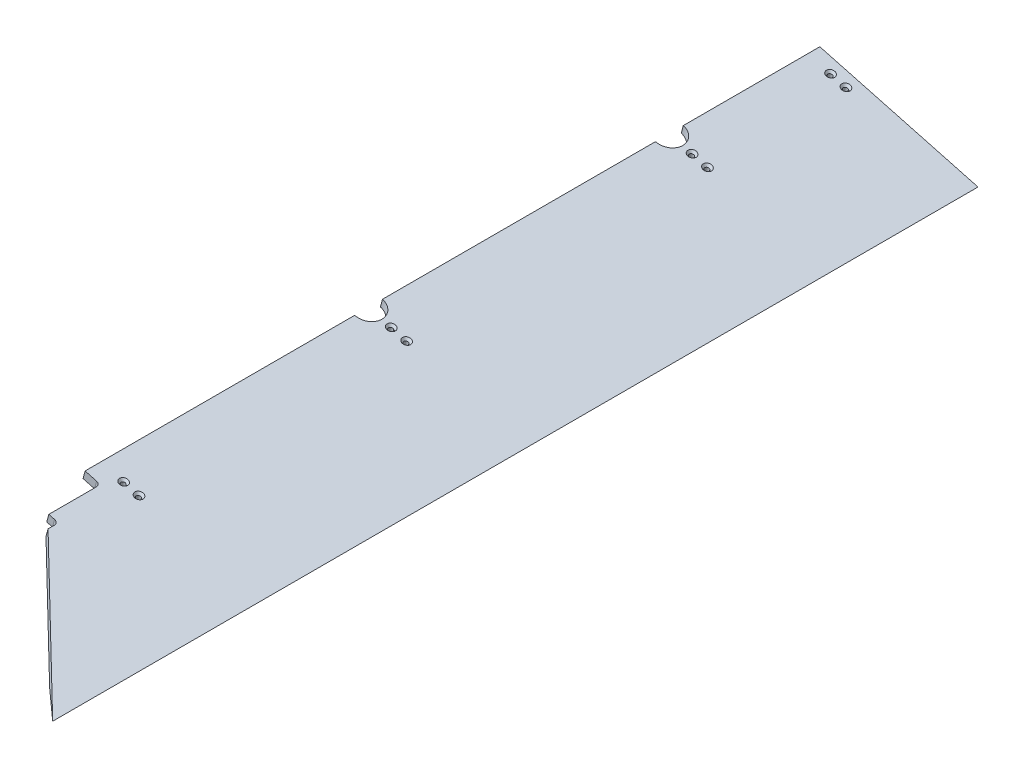
from build123d import *

# Parameters (mm, degrees)
BOSS_EXTRUDE1_DEPTH                                 = 1479.55
CSK_FOR_1_4_FLAT_HEAD_SOCKET_CAP_SCREW1_D           = 7.14248
CSK_FOR_1_4_FLAT_HEAD_SOCKET_CAP_SCREW1_CSINK_D     = 13.4874
CSK_FOR_1_4_FLAT_HEAD_SOCKET_CAP_SCREW1_CSINK_ANGLE = 82
SKETCH4_R                                           = 22.225
CUT_EXTRUDE1_DEPTH                                  = 1504.795800006
CUT_EXTRUDE2_DEPTH                                  = 1504.795800006
FILLET1_R                                           = 6.35


with BuildPart() as part:
    # Sketch1 → Boss-Extrude1 (new body)
    with BuildSketch(Plane.XY):
        Polygon((22.225, 55.50367642), (229.367540407, 0), (278.436572382, 0), (25.512001873, 67.770934414), align=None)
    extrude(amount=BOSS_EXTRUDE1_DEPTH)

    # CSK for 1/4 Flat Head Socket Cap Screw1 (through all)
    with Locations(Plane(origin=(18.651713678, 69.609143096, 0), x_dir=(0.9659258262890675, -0.2588190451025241, 0), z_dir=(0.2588190451025241, 0.9659258262890675, 0))):
        with Locations((44.668892959, -721.51875), (70.068892959, -721.51875), (44.668892959, -240.50625), (70.068892959, -240.50625), (44.668892959, -1149.35), (70.068892959, -1149.35), (44.668892959, -19.05), (70.068892959, -19.05)):
            CounterSinkHole(CSK_FOR_1_4_FLAT_HEAD_SOCKET_CAP_SCREW1_D / 2, CSK_FOR_1_4_FLAT_HEAD_SOCKET_CAP_SCREW1_CSINK_D / 2, counter_sink_angle=CSK_FOR_1_4_FLAT_HEAD_SOCKET_CAP_SCREW1_CSINK_ANGLE)

    # Sketch4 → Cut-Extrude1 (cut, through all)
    with BuildSketch(Plane(origin=(18.651713678, 69.609143096, 0), x_dir=(0.9659258262890675, -0.2588190451025241, 0), z_dir=(0.2588190451025241, 0.9659258262890675, 0))):
        with Locations((7.102292959, -240.50625)):
            Circle(SKETCH4_R)
        with Locations((7.102292959, -721.51875)):
            Circle(SKETCH4_R)
    extrude(amount=-CUT_EXTRUDE1_DEPTH, mode=Mode.SUBTRACT)

    # Sketch5 → Cut-Extrude2 (cut, through all)
    with BuildSketch(Plane(origin=(18.651713678, 69.609143096, 0), x_dir=(0.9659258262890675, -0.25881904510252407, 0), z_dir=(0.25881904510252407, 0.9659258262890675, 0))):
        Polygon((268.949076248, -1479.55), (48.377292959, -1273.863484507), (48.377292959, -1257.3), (32.502292959, -1257.3), (32.502292959, -1174.75), (7.102292959, -1174.75), (7.102292959, -1479.55), align=None)
    extrude(amount=-CUT_EXTRUDE2_DEPTH, mode=Mode.SUBTRACT)

    # Fillet1
    fillet1_edges = [part.edges().sort_by_distance(p)[0] for p in [
        (63.737089416, 50.954549331, 1257.3),
        (48.403016924, 55.063301672, 1174.75),
    ]]
    fillet(fillet1_edges, radius=FILLET1_R)


solid = part.part
